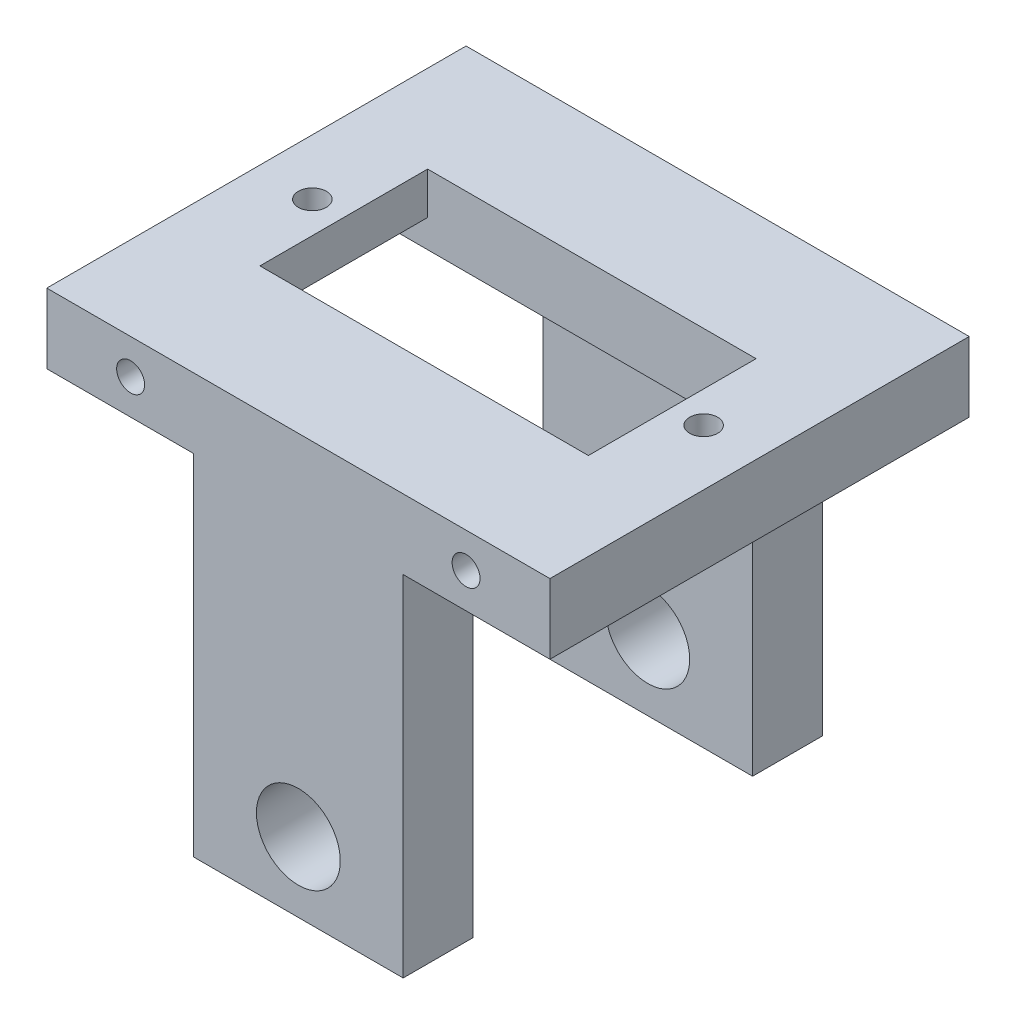
from build123d import *

# Parameters (mm, degrees)
SKETCH_1_W               = 36
SKETCH_1_H               = 30
EXTRUDE_1_DEPTH          = 5
SKETCH_4_W               = 33
SKETCH_4_H               = 12
CUT_EXTRUDE_2_DEPTH      = 2
SKETCH_8_R               = 1
CUT_EXTRUDE_6_DEPTH      = 3
CUT_EXTRUDE_3_DEPTH      = 24.622023622
CUT_EXTRUDE_3_DEPTH_BACK = 3
SKETCH_5_W               = 23.5
SKETCH_5_H               = 12
SKETCH_9_R               = 1
CUT_EXTRUDE_7_DEPTH      = 5
SKETCH_11_W              = 15
SKETCH_11_H              = 5
EXTRUDE_3_DEPTH          = 25
CUT_EXTRUDE_8_REACH      = 45
SKETCH_12_R              = 3


with BuildPart() as part:
    # 草图1 → 凸台-拉伸1 (new body)
    with BuildSketch(Plane(origin=(0, 0, 0), x_dir=(1, 0, 0), z_dir=(0, 1, 0))):
        Rectangle(SKETCH_1_W, SKETCH_1_H)
    extrude(amount=EXTRUDE_1_DEPTH)

    # 草图4 → 切除-拉伸2 (cut)
    with BuildSketch(Plane.XZ):
        Rectangle(SKETCH_4_W, SKETCH_4_H)
    extrude(amount=-CUT_EXTRUDE_2_DEPTH, mode=Mode.SUBTRACT)

    # 草图8 → 切除-拉伸6 (cut)
    with BuildSketch(Plane.XZ.offset(-2)):
        with Locations(Location((14, 0, 0), (0, 0, 270))):
            Circle(SKETCH_8_R)
        with Locations(Location((-14, 0, 0), (0, 0, 270))):
            Circle(SKETCH_8_R)
    extrude(amount=-CUT_EXTRUDE_6_DEPTH, mode=Mode.SUBTRACT)

    # 草图5 → 切除-拉伸3 (cut, two sides: drawn at the far end of the back side and taken through both)
    with BuildSketch(Plane.XZ.offset(-2).offset(-CUT_EXTRUDE_3_DEPTH_BACK)):
        Rectangle(SKETCH_5_W, SKETCH_5_H)
    extrude(amount=CUT_EXTRUDE_3_DEPTH + CUT_EXTRUDE_3_DEPTH_BACK, mode=Mode.SUBTRACT)

    # 草图9 → 切除-拉伸7 (cut)
    with BuildSketch(Plane(origin=(0, 0, -15), x_dir=(-1, 0, 0), z_dir=(0, 0, -1))):
        with Locations((12, 2.5)):
            Circle(SKETCH_9_R)
        with Locations(Location((-12, 2.5, 0), (0, 0, 180))):
            Circle(SKETCH_9_R)
    cut_extrude_7 = extrude(amount=-CUT_EXTRUDE_7_DEPTH, mode=Mode.SUBTRACT)

    # 镜向1: 切除-拉伸7 across plane
    add(cut_extrude_7.mirror(Plane.XY), mode=Mode.SUBTRACT)

    # 草图11 → 凸台-拉伸3 (add)
    with BuildSketch(Plane.XZ):
        with Locations((0, 12.5)):
            Rectangle(SKETCH_11_W, SKETCH_11_H)
        with Locations((0, -12.5)):
            Rectangle(SKETCH_11_W, SKETCH_11_H)
    extrude(amount=EXTRUDE_3_DEPTH)

    # 切除-拉伸8: up to this face of the body (flat: up to its plane)
    cut_extrude_8_end = Plane(part.part.faces().sort_by_distance((0, -7.75118941, 15))[0])
    # 草图12 → 切除-拉伸8 (cut, up to the picked face)
    with BuildSketch(Plane(origin=(0, 0, -15), x_dir=(-1, 0, 0), z_dir=(0, 0, -1)), mode=Mode.PRIVATE) as cut_extrude_8_sk1:
        with Locations((0, -20)):
            Circle(SKETCH_12_R)
    cut_extrude_8_tool1 = split(extrude(cut_extrude_8_sk1.sketch, amount=-CUT_EXTRUDE_8_REACH, mode=Mode.PRIVATE), bisect_by=cut_extrude_8_end, keep=Keep.BOTH, mode=Mode.PRIVATE)
    add(cut_extrude_8_tool1.solids().sort_by(Axis((0, -20, -15), (0, 0, 1)))[0], mode=Mode.SUBTRACT)


solid = part.part
